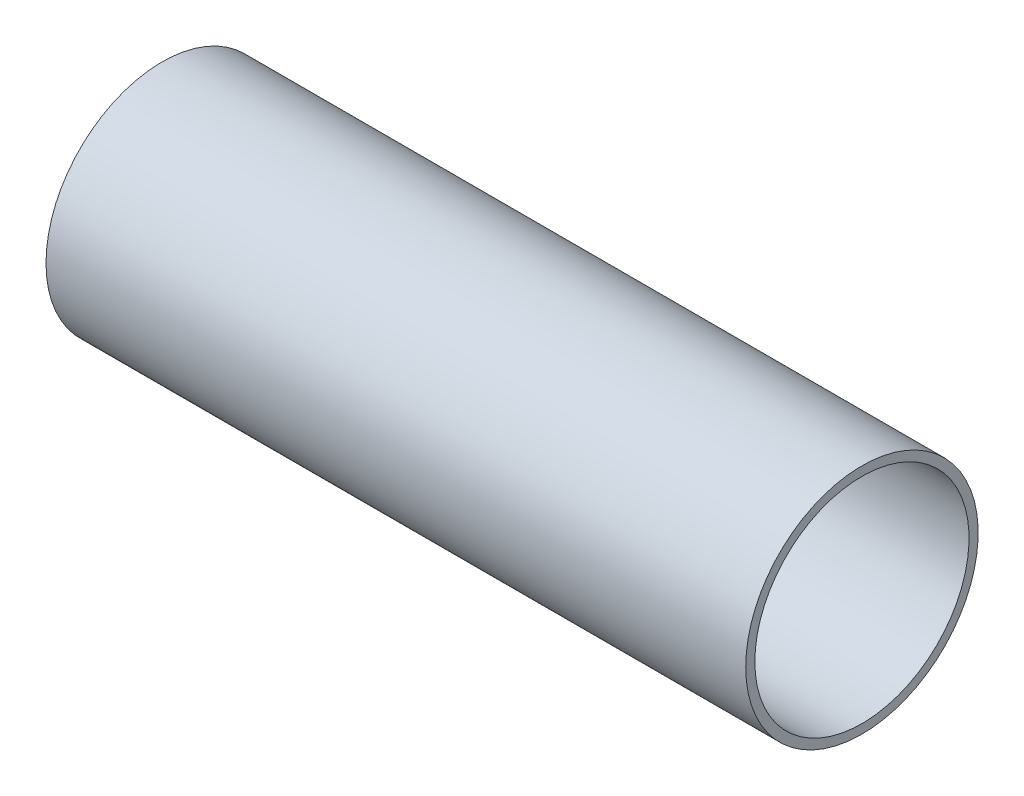
from build123d import *

# Parameters (mm, degrees)
SKETCH1_W = 95.5802
SKETCH1_H = 1.2446


with BuildPart() as part:
    # Sketch1 → Revolve1 (revolve)
    with BuildSketch(Plane(origin=(0, 0, 0), x_dir=(1, 0, 0), z_dir=(0, 1, 0)), mode=Mode.PRIVATE) as revolve1_sk:
        with Locations((0, 15.2527)):
            Rectangle(SKETCH1_W, SKETCH1_H)
    revolve(revolve1_sk.sketch.rotate(Axis((-72.893991897, 0, 0), (1, 0, 0)), 180), axis=Axis((-72.893991897, 0, 0), (1, 0, 0)))


solid = part.part
